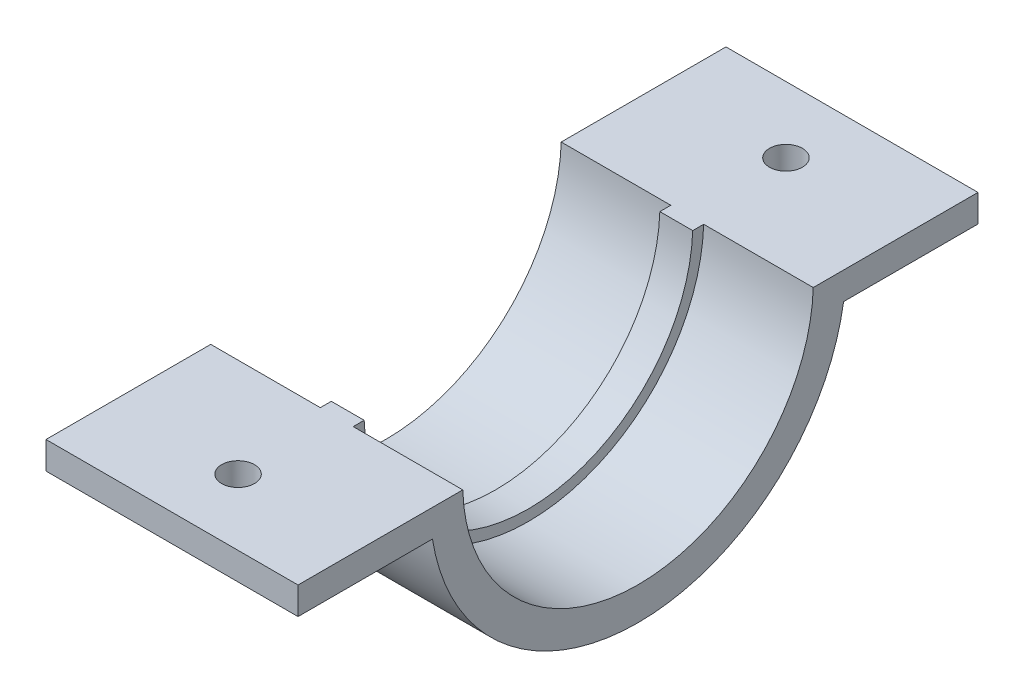
from build123d import *

# Parameters (mm, degrees)
SKETCH3_W           = 13.566130208
SKETCH3_H           = 6
BOSS_EXTRUDE1_DEPTH = 11.5
SKETCH4_R           = 1.5
CUT_EXTRUDE1_DEPTH  = 11.5
SKETCH5_W           = 75.75040558
SKETCH5_H           = 1
CUT_EXTRUDE2_DEPTH  = 26


with BuildPart() as part:
    # Sketch2 → Revolve1 (revolve)
    with BuildSketch(Plane(origin=(0, 0, 0), x_dir=(1, 0, 0), z_dir=(0, 1, 0)), mode=Mode.PRIVATE) as revolve1_sk:
        Polygon((-11.5, 16), (-1.5, 16), (-1.5, 15), (1.5, 15), (1.5, 16), (11.5, 16), (11.5, 19), (-11.5, 19), align=None)
    revolve(revolve1_sk.sketch.rotate(Axis((-71.722155375, 0, 0), (1, 0, 0)), 180), axis=Axis((-71.722155375, 0, 0), (1, 0, 0)))

    # Sketch3 → Boss-Extrude1 (add, symmetric)
    with BuildSketch(Plane(origin=(0, 0, 0), x_dir=(0, 0, -1), z_dir=(1, 0, 0))):
        with Locations((24.243185686, 0)):
            Rectangle(SKETCH3_W, SKETCH3_H)
        with Locations((-24.243185686, 0)):
            Rectangle(SKETCH3_W, SKETCH3_H)
    extrude(amount=BOSS_EXTRUDE1_DEPTH, both=True)

    # Sketch4 → Cut-Extrude1 (cut, symmetric)
    with BuildSketch(Plane(origin=(0, 0, 0), x_dir=(1, 0, 0), z_dir=(0, 1, 0))):
        with Locations(Location((0, 25, 0), (0, 0, 270))):
            Circle(SKETCH4_R)
        with Locations(Location((0, -25, 0), (0, 0, 270))):
            Circle(SKETCH4_R)
    extrude(amount=CUT_EXTRUDE1_DEPTH, both=True, mode=Mode.SUBTRACT)

    # Sketch5 → Cut-Extrude2 (cut, symmetric)
    with BuildSketch(Plane(origin=(0, 0, 0), x_dir=(0, 0, -1), z_dir=(1, 0, 0))):
        Rectangle(SKETCH5_W, SKETCH5_H)
    extrude(amount=CUT_EXTRUDE2_DEPTH, both=True, mode=Mode.SUBTRACT)


with BuildPart() as cut_extrude2_piece_1:
    # of the separate pieces the step leaves, piece 1, a body of its own (cut_extrude2_pieces)
    add(part.part.solids().sort_by_distance((-11.5, 0.5, -15.992185592))[0])


with BuildPart() as cut_extrude2_piece_2:
    # of the separate pieces the step leaves, piece 2, a body of its own (cut_extrude2_pieces)
    add(part.part.solids().sort_by_distance((-11.5, -0.5, 15.992185592))[0])


solid = cut_extrude2_piece_2.part
